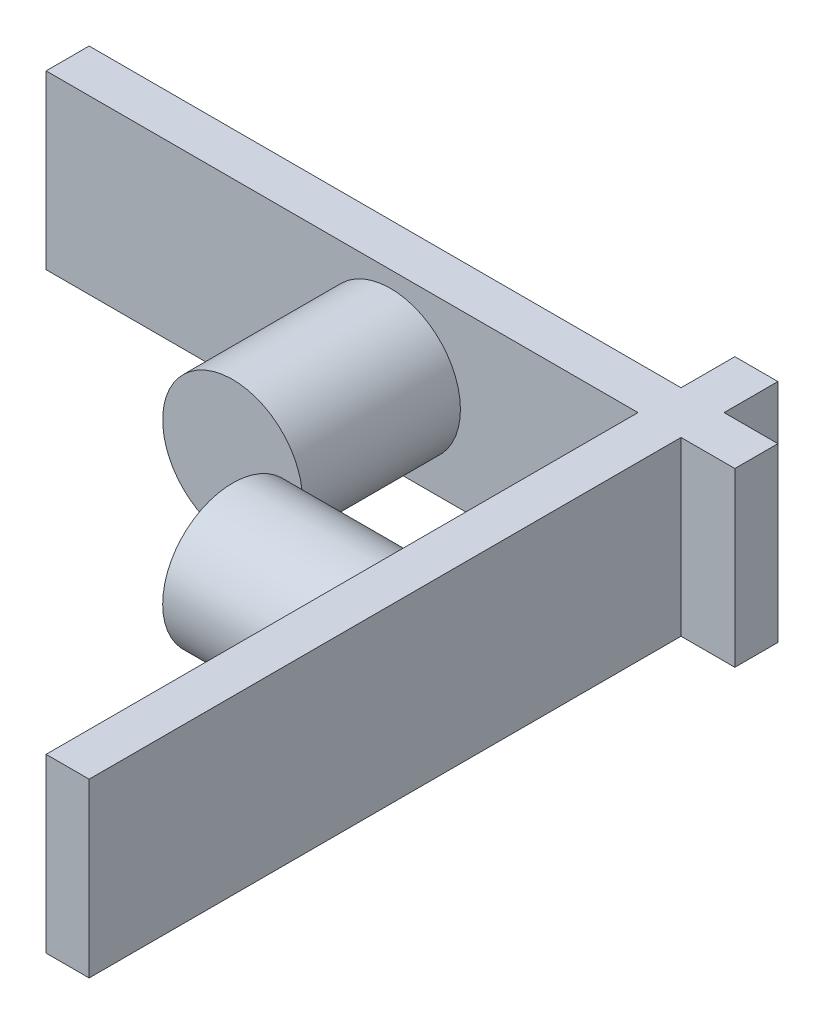
from build123d import *

# Parameters (mm, degrees)
SKETCH1_W           = 48
SKETCH1_H           = 12
BOSS_EXTRUDE1_DEPTH = 3
SKETCH1_3_R         = 4.875
BOSS_EXTRUDE2_DEPTH = 11
CIRPATTERN2_COUNT   = 2
CIRPATTERN2_ANGLE   = 90


with BuildPart() as part:
    # Sketch1 → Boss-Extrude1 (new body)
    with BuildSketch(Plane.XY):
        Rectangle(SKETCH1_W, SKETCH1_H)
    boss_extrude1 = extrude(amount=-BOSS_EXTRUDE1_DEPTH)

    # Sketch1<3> → Boss-Extrude2 (add)
    with BuildSketch(Plane.XY):
        Circle(SKETCH1_3_R)
    boss_extrude2 = extrude(amount=BOSS_EXTRUDE2_DEPTH)

    # CirPattern2: Boss-Extrude1, Boss-Extrude2 ×2 about axis
    cirpattern2_axis = Axis((0, 55, 17.25), (0, -1, 0))
    add([boss_extrude1.rotate(cirpattern2_axis, i * CIRPATTERN2_ANGLE / (CIRPATTERN2_COUNT - 1)) for i in range(1, CIRPATTERN2_COUNT)])
    add([boss_extrude2.rotate(cirpattern2_axis, i * CIRPATTERN2_ANGLE / (CIRPATTERN2_COUNT - 1)) for i in range(1, CIRPATTERN2_COUNT)])


solid = part.part
